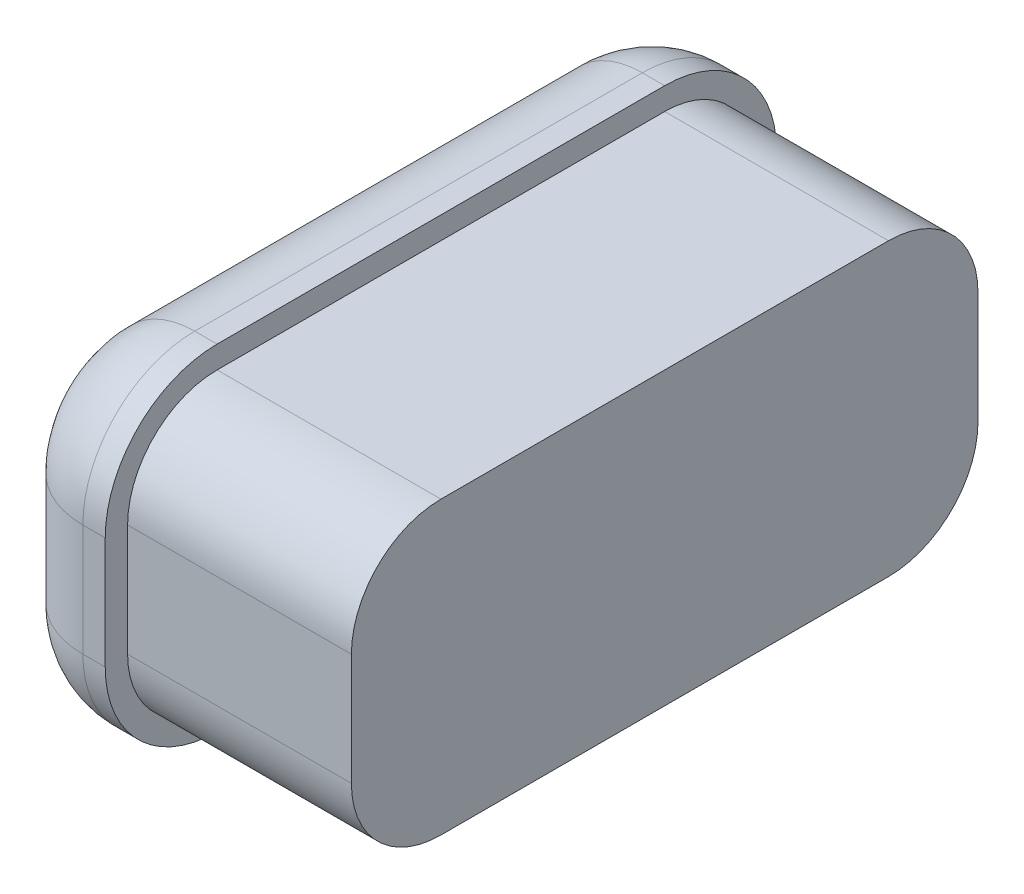
from build123d import *

# Parameters (mm, degrees)
SKETCH_1_W      = 30
SKETCH_1_H      = 15
EXTRUDE_1_DEPTH = 5
SKETCH_2_W      = 28
SKETCH_2_H      = 13
EXTRUDE_2_DEPTH = 10
FILLET_2_R      = 4
FILLET_1_R      = 5
FILLET_3_R      = 4


with BuildPart() as part:
    # Эскиз1 → Бобышка-Вытянуть1 (new body)
    with BuildSketch(Plane(origin=(0, 0, 0), x_dir=(0, 0, -1), z_dir=(1, 0, 0))):
        Rectangle(SKETCH_1_W, SKETCH_1_H)
    extrude(amount=EXTRUDE_1_DEPTH)

    # Эскиз2 → Бобышка-Вытянуть2 (add)
    with BuildSketch(Plane(origin=(5, 0, 0), x_dir=(0, 0, -1), z_dir=(1, 0, 0))):
        Rectangle(SKETCH_2_W, SKETCH_2_H)
    extrude(amount=EXTRUDE_2_DEPTH)

    # Скругление2
    fillet_2_edges = [part.edges().sort_by_distance(p)[0] for p in [
        (10, 6.5, 14),
        (10, -6.5, 14),
        (10, -6.5, -14),
        (10, 6.5, -14),
    ]]
    fillet(fillet_2_edges, radius=FILLET_2_R)

    # Скругление1
    fillet_1_edges = [part.edges().sort_by_distance(p)[0] for p in [
        (2.5, 7.5, 15),
        (2.5, 7.5, -15),
        (2.5, -7.5, -15),
        (2.5, -7.5, 15),
    ]]
    fillet(fillet_1_edges, radius=FILLET_1_R)

    # Скругление3
    fillet_3_edges = [part.edges().sort_by_distance(p)[0] for p in [
        (0, 7.5, 0),
        (0, 0, 15),
        (0, 0, -15),
        (0, -7.5, 0),
        (0, 6.035533906, 13.535533906),
        (0, -6.035533906, 13.535533906),
        (0, -6.035533906, -13.535533906),
        (0, 6.035533906, -13.535533906),
    ]]
    fillet(fillet_3_edges, radius=FILLET_3_R)


solid = part.part
